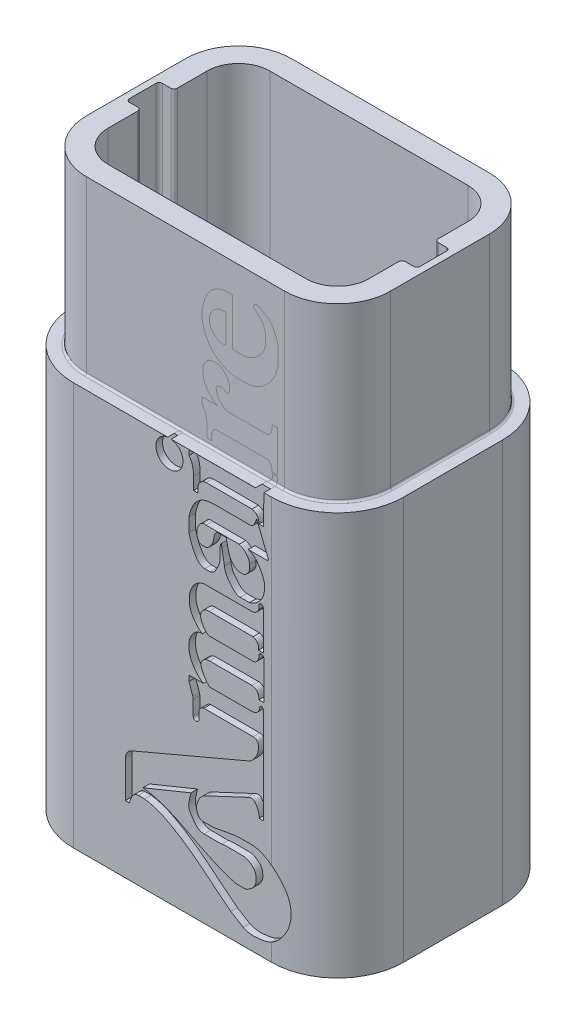
from build123d import *

# Parameters (mm, degrees)
SALIENTE_EXTRUIR1_DEPTH = 61
SALIENTE_EXTRUIR2_DEPTH = 26
VACIADO2_T              = -5.25
REDONDEO1_R             = 0.3
CORTAR_EXTRUIR1_REACH   = 89.26
CROQUIS3_R              = 7.5
CORTAR_EXTRUIR3_DEPTH   = 31.25
CROQUIS7_W              = 3
CROQUIS7_H              = 5
CORTAR_EXTRUIR4_DEPTH   = 81.75
REDONDEO7_R             = 0.5
CORTAR_EXTRUIR5_REACH   = 89.26
CORTAR_EXTRUIR6_DEPTH   = 1
CORTAR_EXTRUIR7_DEPTH   = 2


with BuildPart() as part:
    # Croquis1 → Saliente-Extruir1 (new body)
    with BuildSketch(Plane(origin=(0, 0, 0), x_dir=(1, 0, 0), z_dir=(0, 1, 0))):
        with BuildLine():
            Line((-15, 17.5), (15, 17.5))
            ThreePointArc((15, 17.5), (22.071067812, 14.571067812), (25, 7.5))
            Line((25, 7.5), (25, -7.5))
            ThreePointArc((25, -7.5), (22.071067812, -14.571067812), (15, -17.5))
            Line((15, -17.5), (-15, -17.5))
            ThreePointArc((-15, -17.5), (-22.071067812, -14.571067812), (-25, -7.5))
            Line((-25, -7.5), (-25, 7.5))
            ThreePointArc((-25, 7.5), (-22.071067812, 14.571067812), (-15, 17.5))
        make_face()
    extrude(amount=SALIENTE_EXTRUIR1_DEPTH)

    # Croquis2 → Saliente-Extruir2 (add)
    with BuildSketch(Plane(origin=(0, 61, 0), x_dir=(1, 0, 0), z_dir=(0, 1, 0))):
        with BuildLine():
            Line((15, 15.5), (-15, 15.5))
            ThreePointArc((-15, 15.5), (-20.656854249, 13.156854249), (-23, 7.5))
            Line((-23, 7.5), (-23, -7.5))
            ThreePointArc((-23, -7.5), (-20.656854249, -13.156854249), (-15, -15.5))
            Line((-15, -15.5), (15, -15.5))
            ThreePointArc((15, -15.5), (20.656854249, -13.156854249), (23, -7.5))
            Line((23, -7.5), (23, 7.5))
            ThreePointArc((23, 7.5), (20.656854249, 13.156854249), (15, 15.5))
        make_face()
    extrude(amount=SALIENTE_EXTRUIR2_DEPTH)

    # Vaciado2
    vaciado2_openings = [part.faces().sort_by_distance(p)[0] for p in [
        (0, 87, 0),
    ]]
    offset(amount=VACIADO2_T, openings=vaciado2_openings, kind=Kind.INTERSECTION)

    # Redondeo1
    redondeo1_edges = [part.edges().sort_by_distance(p)[0] for p in [
        (20.656854249, 61, -13.156854249),
        (0, 61, -15.5),
        (-20.656854249, 61, -13.156854249),
        (-23, 61, 0),
        (-20.656854249, 61, 13.156854249),
        (0, 61, 15.5),
        (20.656854249, 61, 13.156854249),
        (23, 61, 0),
    ]]
    fillet(redondeo1_edges, radius=REDONDEO1_R)

    # Croquis3 → Cortar-Extruir1 (cut, up to next)
    with BuildSketch(Plane(origin=(0, 5.25, 0), x_dir=(1, 0, 0), z_dir=(0, 1, 0)), mode=Mode.PRIVATE) as cortar_extruir1_sk1:
        with Locations(Location((0, 0, 0), (0, 0, 270))):
            Circle(CROQUIS3_R)
    cortar_extruir1_tool1 = extrude(cortar_extruir1_sk1.sketch, amount=-CORTAR_EXTRUIR1_REACH, mode=Mode.PRIVATE) & part.part
    add(cortar_extruir1_tool1.solids().sort_by_distance((0, 5.25, 0))[0], mode=Mode.SUBTRACT)

    # Croquis6 → Cortar-Extruir3 (cut)
    with BuildSketch(Plane.XZ.offset(-55.75)):
        with BuildLine():
            Line((19.75, -7.5), (19.75, 7.5))
            ThreePointArc((19.75, 7.5), (18.358757211, 10.858757211), (15, 12.25))
            Line((15, 12.25), (-15, 12.25))
            ThreePointArc((-15, 12.25), (-18.358757211, 10.858757211), (-19.75, 7.5))
            Line((-19.75, 7.5), (-19.75, -7.5))
            ThreePointArc((-19.75, -7.5), (-18.358757211, -10.858757211), (-15, -12.25))
            Line((-15, -12.25), (15, -12.25))
            ThreePointArc((15, -12.25), (18.358757211, -10.858757211), (19.75, -7.5))
        make_face()
        with BuildLine():
            Line((15, 10.25), (-15, 10.25))
            ThreePointArc((-15, 10.25), (-16.944543648, 9.444543648), (-17.75, 7.5))
            Line((-17.75, 7.5), (-17.75, -7.5))
            ThreePointArc((-17.75, -7.5), (-16.944543648, -9.444543648), (-15, -10.25))
            Line((-15, -10.25), (15, -10.25))
            ThreePointArc((15, -10.25), (16.944543648, -9.444543648), (17.75, -7.5))
            Line((17.75, -7.5), (17.75, 7.5))
            ThreePointArc((17.75, 7.5), (16.944543648, 9.444543648), (15, 10.25))
        make_face(mode=Mode.SUBTRACT)
    extrude(amount=-CORTAR_EXTRUIR3_DEPTH, mode=Mode.SUBTRACT)

    # Croquis7 → Cortar-Extruir4 (cut)
    with BuildSketch(Plane(origin=(0, 5.25, 0), x_dir=(1, 0, 0), z_dir=(0, 1, 0))):
        with Locations((-20.5, 0)):
            Rectangle(CROQUIS7_W, CROQUIS7_H)
        with Locations((20.5, 0)):
            Rectangle(CROQUIS7_W, CROQUIS7_H)
    extrude(amount=CORTAR_EXTRUIR4_DEPTH, mode=Mode.SUBTRACT)

    # Redondeo7
    redondeo7_edges = [part.edges().sort_by_distance(p)[0] for p in [
        (-22, 46.125, -2.5),
        (-19.75, 46.125, 2.5),
        (-22, 46.125, 2.5),
        (-19.75, 46.125, -2.5),
        (22, 46.125, 2.5),
        (19.75, 46.125, -2.5),
        (22, 46.125, -2.5),
        (19.75, 46.125, 2.5),
    ]]
    fillet(redondeo7_edges, radius=REDONDEO7_R)

    # Croquis8 → Cortar-Extruir5 (cut, up to next)
    with BuildSketch(Plane(origin=(0, 5.25, 0), x_dir=(1, 0, 0), z_dir=(0, 1, 0)), mode=Mode.PRIVATE) as cortar_extruir5_sk1:
        with BuildLine():
            Line((-1.5, 10.071067812), (1.5, 10.071067812))
            ThreePointArc((1.5, 10.071067812), (2.207106781, 9.778174593), (2.5, 9.071067812))
            Line((2.5, 9.071067812), (2.5, 7.071067812))
            Line((2.5, 7.071067812), (-2.5, 7.071067812))
            Line((-2.5, 7.071067812), (-2.5, 9.071067812))
            ThreePointArc((-2.5, 9.071067812), (-2.207106781, 9.778174593), (-1.5, 10.071067812))
        make_face()
    cortar_extruir5_tool1 = extrude(cortar_extruir5_sk1.sketch, amount=-CORTAR_EXTRUIR5_REACH, mode=Mode.PRIVATE) & part.part
    # Croquis8 → Cortar-Extruir5 (cut, up to next)
    with BuildSketch(Plane(origin=(0, 5.25, 0), x_dir=(1, 0, 0), z_dir=(0, 1, 0)), mode=Mode.PRIVATE) as cortar_extruir5_sk2:
        with BuildLine():
            Line((9.071067812, 2.5), (7.071067812, 2.5))
            Line((7.071067812, 2.5), (7.071067812, -2.5))
            Line((7.071067812, -2.5), (9.071067812, -2.5))
            ThreePointArc((9.071067812, -2.5), (9.778174593, -2.207106781), (10.071067812, -1.5))
            Line((10.071067812, -1.5), (10.071067812, 1.5))
            ThreePointArc((10.071067812, 1.5), (9.778174593, 2.207106781), (9.071067812, 2.5))
        make_face()
    cortar_extruir5_tool2 = extrude(cortar_extruir5_sk2.sketch, amount=-CORTAR_EXTRUIR5_REACH, mode=Mode.PRIVATE) & part.part
    # Croquis8 → Cortar-Extruir5 (cut, up to next)
    with BuildSketch(Plane(origin=(0, 5.25, 0), x_dir=(1, 0, 0), z_dir=(0, 1, 0)), mode=Mode.PRIVATE) as cortar_extruir5_sk3:
        with BuildLine():
            Line((2.5, -9.071067812), (2.5, -7.071067812))
            Line((2.5, -7.071067812), (-2.5, -7.071067812))
            Line((-2.5, -7.071067812), (-2.5, -9.071067812))
            ThreePointArc((-2.5, -9.071067812), (-2.207106781, -9.778174593), (-1.5, -10.071067812))
            Line((-1.5, -10.071067812), (1.5, -10.071067812))
            ThreePointArc((1.5, -10.071067812), (2.207106781, -9.778174593), (2.5, -9.071067812))
        make_face()
    cortar_extruir5_tool3 = extrude(cortar_extruir5_sk3.sketch, amount=-CORTAR_EXTRUIR5_REACH, mode=Mode.PRIVATE) & part.part
    # Croquis8 → Cortar-Extruir5 (cut, up to next)
    with BuildSketch(Plane(origin=(0, 5.25, 0), x_dir=(1, 0, 0), z_dir=(0, 1, 0)), mode=Mode.PRIVATE) as cortar_extruir5_sk4:
        with BuildLine():
            Line((-9.071067812, -2.5), (-7.071067812, -2.5))
            Line((-7.071067812, -2.5), (-7.071067812, 2.5))
            Line((-7.071067812, 2.5), (-9.071067812, 2.5))
            ThreePointArc((-9.071067812, 2.5), (-9.778174593, 2.207106781), (-10.071067812, 1.5))
            Line((-10.071067812, 1.5), (-10.071067812, -1.5))
            ThreePointArc((-10.071067812, -1.5), (-9.778174593, -2.207106781), (-9.071067812, -2.5))
        make_face()
    cortar_extruir5_tool4 = extrude(cortar_extruir5_sk4.sketch, amount=-CORTAR_EXTRUIR5_REACH, mode=Mode.PRIVATE) & part.part
    add(cortar_extruir5_tool1.solids().sort_by_distance((0, 5.25, -8.533463))[0], mode=Mode.SUBTRACT)
    add(cortar_extruir5_tool2.solids().sort_by_distance((8.533463, 5.25, 0))[0], mode=Mode.SUBTRACT)
    add(cortar_extruir5_tool3.solids().sort_by_distance((0, 5.25, 8.533463))[0], mode=Mode.SUBTRACT)
    add(cortar_extruir5_tool4.solids().sort_by_distance((-8.533463, 5.25, 0))[0], mode=Mode.SUBTRACT)

    # Croquis12 → Cortar-Extruir6 (cut)
    # profile 1 of 4: a face of its own
    with BuildSketch(Plane.XY.offset(17.5)):
        with BuildLine():
            Line((8.839211837, 3.583016121), (10.717378559, 2.448750729))
            add(Edge.make_bspline(
                [(10.717378559, 2.448750729), (11.57151276, 1.992908575), (12.833194057, 2.068391278), (14.284742415, 2.323841876), (14.785601891, 2.538291683), (15, 2.654255198)],
                knots=[0, 0, 0, 0, 0.110699318, 0.146587548, 0.175473468, 0.175473468, 0.175473468, 0.175473468], degree=3))
            add(Edge.make_bspline(
                [(15, 2.654255198), (15.439441542, 2.891940063), (15.821183504, 3.199624631), (16.32789766, 3.742235966), (16.483231519, 3.935082502), (16.763900815, 4.337452763), (16.889919542, 4.54799845), (17.113674208, 4.987937813), (17.210809933, 5.216508236), (17.373276031, 5.679853562), (17.439364062, 5.916052732), (17.542494062, 6.397257135), (17.579619908, 6.643904279), (17.623710647, 7.136476573), (17.638158034, 7.628226678), (17.595541347, 8.118391174), (17.5236616, 8.607746805), (17.472782707, 8.851451729), (17.280521565, 9.563069163), (17.099711225, 10.018169016), (16.639584889, 10.893600197), (16.366888971, 11.301223226), (15.743538376, 12.058376014), (15.389473625, 12.410261964), (15, 12.719037435)],
                knots=[0, 0, 0, 0, 0.125, 0.125, 0.1875, 0.1875, 0.25, 0.25, 0.3125, 0.3125, 0.375, 0.375, 0.4375, 0.4375, 0.5, 0.5625, 0.5625, 0.625, 0.625, 0.75, 0.75, 0.875, 0.875, 1, 1, 1, 1], degree=3))
            add(Edge.make_bspline(
                [(15, 12.719037435), (14.836502756, 12.848658379), (14.156768101, 13.33788541), (12.86992764, 13.933832597), (10.93208066, 13.947892843), (8.728536164, 13.855241706), (7.114546126, 13.41627319), (6.210708059, 13.288192066)],
                knots=[0.637512638, 0.637512638, 0.637512638, 0.637512638, 0.66233274, 0.736891382, 0.801940894, 0.890990195, 1, 1, 1, 1], degree=3))
            Line((6.210708059, 13.288192066), (4.469200106, 13.288192066))
            add(Edge.make_bspline(
                [(4.469200106, 13.288192066), (3.627161847, 13.632506122), (3.457839165, 15.425230162), (4.488611443, 16.650693169), (5.225852576, 16.936315268)],
                knots=[0, 0, 0, 0, 0.504715202, 1, 1, 1, 1], degree=3))
            Line((5.225852576, 16.936315268), (11.341427702, 19.803222446))
            add(Edge.make_bspline(
                [(11.341427702, 19.803222446), (12.054473478, 20.172278232), (12.637173074, 19.779522002), (13.201444155, 18.547801031), (13.144488155, 17.954358588)],
                knots=[0, 0, 0, 0, 0.367215736, 1, 1, 1, 1], degree=3))
            Line((13.144488155, 17.954358588), (13.753717827, 17.954358588))
            Line((13.753717827, 17.954358588), (13.753717827, 32.534911479))
            ThreePointArc((13.753717827, 32.534911479), (13.488425616, 32.791359046), (13.223133405, 32.534911479))
            add(Edge.make_bspline(
                [(13.223133405, 32.534911479), (13.215001476, 32.295131831), (13.054278265, 31.711951829), (12.474315741, 31.495679929), (12.203438302, 31.410580989)],
                knots=[0, 0, 0, 0, 0.450574226, 1, 1, 1, 1], degree=3))
            Line((12.203438302, 31.410580989), (5.606071271, 31.410580989))
            add(Edge.make_bspline(
                [(5.606071271, 31.410580989), (5.146499522, 31.872242801), (4.61752502, 32.611723133), (4.287669726, 33.60736524), (4.361329758, 34.113086922), (4.736192448, 34.60744645), (5.215658678, 34.831363959), (5.606071271, 34.824708089)],
                knots=[0, 0, 0, 0, 0.423126115, 0.602373381, 0.670712459, 0.750833857, 1, 1, 1, 1], degree=3))
            Line((5.606071271, 34.824708089), (12.033103981, 34.824708089))
            add(Edge.make_bspline(
                [(12.033103981, 34.824708089), (12.724694773, 34.834167703), (13.182039204, 34.097752865), (13.097016367, 33.471702843)],
                knots=[0, 0, 0, 0, 1, 1, 1, 1], degree=3))
            Line((13.097016367, 33.471702843), (13.837263132, 33.471702843))
            Line((13.837263132, 33.471702843), (13.837263132, 39.253100651))
            ThreePointArc((13.837263132, 39.253100651), (13.467139749, 39.651933844), (13.097016367, 39.253100651))
            add(Edge.make_bspline(
                [(13.097016367, 39.253100651), (13.136464163, 38.725556963), (12.782038468, 38.111566482), (12.203438302, 38.075965764)],
                knots=[0, 0, 0, 0, 1, 1, 1, 1], degree=3))
            Line((12.203438302, 38.075965764), (5.547357888, 38.075965764))
            add(Edge.make_bspline(
                [(5.547357888, 38.075965764), (5.144189999, 38.189826714), (4.633272205, 38.90097659), (4.162459873, 39.904636812), (4.446579724, 41.018611774), (5.135275013, 41.334215678), (5.547357888, 41.296087898)],
                knots=[0, 0, 0, 0, 0.274690439, 0.562076696, 0.721942945, 1, 1, 1, 1], degree=3))
            Line((5.547357888, 41.296087898), (12.203438302, 41.296087898))
            add(Edge.make_bspline(
                [(12.203438302, 41.296087898), (12.771063201, 41.156708415), (13.202012477, 40.523510491), (13.032571939, 39.942966797)],
                knots=[0, 0, 0, 0, 1, 1, 1, 1], degree=3))
            Line((13.032571939, 39.942966797), (13.753717827, 39.942966797))
            Line((13.753717827, 39.942966797), (13.753717827, 45.891922131))
            ThreePointArc((13.753717827, 45.891922131), (13.433316373, 46.203340455), (13.11291492, 45.891922131))
            Line((13.11291492, 45.891922131), (13.097016367, 45.332930437))
            add(Edge.make_bspline(
                [(13.097016367, 45.332930437), (12.833869284, 44.618628689), (12.089132907, 44.522899109)],
                knots=[0, 0, 0, 1, 1, 1], degree=2))
            Line((12.089132907, 44.522899109), (4.878009071, 44.522899109))
            add(Edge.make_bspline(
                [(4.878009071, 44.522899109), (2.977027214, 44.264896519), (1.809187864, 40.771717503), (3.596770436, 38.473383224), (4.518193173, 37.828668084)],
                knots=[0, 0, 0, 0, 0.604964868, 1, 1, 1, 1], degree=3))
            add(Edge.make_bspline(
                [(4.518193173, 37.828668084), (3.732085133, 37.893846761), (2.622380687, 36.822945378), (2.247877206, 34.006879288), (3.540265622, 32.164048112), (4.679290925, 31.410580989)],
                knots=[0, 0, 0, 0, 0.268806293, 0.492798793, 1, 1, 1, 1], degree=3))
            Line((4.679290925, 31.410580989), (2.500918979, 31.410580989))
            Line((2.500918979, 31.410580989), (2.500918979, 30.567340236))
            Line((2.500918979, 30.567340236), (3.092546042, 28.905085597))
            ThreePointArc((3.092546042, 28.905085597), (3.135859711, 28.739909553), (3.150439311, 28.569772448))
            Line((3.150439311, 28.569772448), (3.150439311, 26.348861371))
            ThreePointArc((3.150439311, 26.348861371), (3.578274675, 25.921026008), (4.006110038, 26.348861371))
            Line((4.006110038, 26.348861371), (4.006110038, 27.493610047))
            add(Edge.make_bspline(
                [(4.006110038, 27.493610047), (4.178165485, 28.062386245), (4.761458333, 28.193395808)],
                knots=[0, 0, 0, 1, 1, 1], degree=2))
            Line((4.761458333, 28.193395808), (12.203438302, 28.193395808))
            add(Edge.make_bspline(
                [(12.203438302, 28.193395808), (12.876284158, 28.187443245), (13.323257717, 26.673308023), (12.491951558, 25.388573232), (11.815008673, 24.790967296)],
                knots=[0, 0, 0, 0, 0.347774106, 1, 1, 1, 1], degree=3))
            Line((11.815008673, 24.790967296), (-6.140696224, 17.152184365))
            add(Edge.make_bspline(
                [(-6.140696224, 17.152184365), (-7.06275562, 16.735030098), (-7.120593366, 15.721338435)],
                knots=[0, 0, 0, 1, 1, 1], degree=2))
            Line((-7.120593366, 15.721338435), (-7.120593366, 10.1336631))
            Line((-7.120593366, 10.1336631), (-6.54072951, 10.1336631))
            add(Edge.make_bspline(
                [(-6.54072951, 10.1336631), (-6.302525785, 10.770955801), (-6.067313414, 11.822632186), (-5.15727482, 11.811981922)],
                knots=[0, 0, 0, 0, 1, 1, 1, 1], degree=3))
            Line((-5.15727482, 11.811981922), (-4.208794013, 11.811981922))
            add(Edge.make_bspline(
                [(-4.208794013, 11.811981922), (-2.764436782, 11.633273815), (2.05605331, 9.51758502), (5.883582234, 5.856502973), (8.839211837, 3.583016121)],
                knots=[0, 0, 0, 0, 0.276950224, 1, 1, 1, 1], degree=3))
        make_face()
        with BuildLine():
            Line((9.52240161, 7.634356159), (11.065169804, 7.634356159))
            add(Edge.make_bspline(
                [(11.065169804, 7.634356159), (11.78995243, 7.867040882), (12.742944997, 8.756419367), (12.689327825, 10.003253389), (12.523332553, 10.78586972), (11.934738414, 11.348219099), (11.240384605, 11.751715912), (10.561697801, 11.830618826), (9.825488984, 11.805360715), (8.75774332, 11.813153641), (7.931487036, 11.822106284), (7.415172777, 11.723658503)],
                knots=[0, 0, 0, 0, 0.258068931, 0.344056016, 0.395908481, 0.514195451, 0.591542714, 0.6539393, 0.731991711, 0.831118274, 1, 1, 1, 1], degree=3))
            Line((7.415172777, 11.723658503), (4.797081459, 11.723658503))
            add(Edge.make_bspline(
                [(4.797081459, 11.723658503), (3.930766451, 11.711394291), (3.140212556, 12.70791639), (2.198786219, 14.330803789), (2.714890092, 15.496848038), (2.796732511, 16.118255614)],
                knots=[0, 0, 0, 0, 0.442283824, 0.611703227, 1, 1, 1, 1], degree=3))
            Line((2.796732511, 16.118255614), (-4.480049519, 13.150453386))
            add(Edge.make_bspline(
                [(-4.480049519, 13.150453386), (-2.655693689, 12.976130266), (1.393579189, 11.472757348), (5.733952227, 8.84403454), (8.818966871, 7.870468), (9.52240161, 7.634356159)],
                knots=[0, 0, 0, 0, 0.359356466, 0.85256814, 1, 1, 1, 1], degree=3))
        make_face(mode=Mode.SUBTRACT)
    # profile 2 of 4: a face of its own
    with BuildSketch(Plane.XY.offset(17.5)):
        with BuildLine():
            Line((11.492004893, 52.375748015), (14.331933762, 52.375748015))
            ThreePointArc((14.331933762, 52.375748015), (14.492691159, 52.461082808), (14.512088153, 52.642048895))
            Line((14.512088153, 52.642048895), (13.279747614, 55.716464977))
            Line((13.279747614, 55.716464977), (12.769675908, 56.987837595))
            add(Edge.make_bspline(
                [(12.769675908, 56.987837595), (12.648557654, 56.786183877), (12.486237294, 56.400747267), (12.265670553, 55.735908684), (11.815008673, 55.716464977)],
                knots=[0, 0, 0, 0, 0.319064042, 1, 1, 1, 1], degree=3))
            Line((11.815008673, 55.716464977), (6.210708059, 55.716464977))
            add(Edge.make_bspline(
                [(6.210708059, 55.716464977), (5.555162796, 55.693827315), (4.524691356, 55.52871533), (3.078761845, 54.25092926), (2.676682829, 53.016399971), (2.500918979, 52.138550548)],
                knots=[0, 0, 0, 0, 0.355063263, 0.516259989, 1, 1, 1, 1], degree=3))
            Line((2.500918979, 52.138550548), (2.500918979, 50.078886466))
            add(Edge.make_bspline(
                [(2.500918979, 50.078886466), (2.67318588, 49.313349475), (3.155493412, 47.99812536), (4.115182609, 46.606423341), (4.878009071, 46.563592823)],
                knots=[0, 0, 0, 0, 0.51301477, 1, 1, 1, 1], degree=3))
            Line((4.878009071, 46.563592823), (5.714767431, 46.563592823))
            add(Edge.make_bspline(
                [(5.714767431, 46.563592823), (6.243276049, 46.630762079), (6.633362058, 47.291522475), (7.142454693, 48.287502539), (7.233389841, 48.925627303), (7.233389841, 49.307196041)],
                knots=[0, 0, 0, 0, 0.405494088, 0.676354081, 1, 1, 1, 1], degree=3))
            Line((7.233389841, 49.307196041), (7.233389841, 50.615830926))
            add(Edge.make_bspline(
                [(7.233389841, 50.615830926), (7.233389841, 50.685510677), (7.258717074, 50.858797403), (7.299184894, 51.038897718), (7.414788877, 51.073138121), (7.450668403, 51.006236209), (7.44509675, 50.841668495), (7.440902814, 50.821484908), (7.478073382, 50.615830926)],
                knots=[0, 0, 0, 0, 0.283846614, 0.469195573, 0.535338885, 0.577900949, 0.677403481, 1, 1, 1, 1], degree=3))
            Line((7.478073382, 50.615830926), (7.872015, 48.43626608))
            add(Edge.make_bspline(
                [(7.872015, 48.43626608), (7.948469403, 47.5675699), (8.634057943, 46.574275946), (9.718190618, 45.490747845), (10.259634817, 45.490747845)],
                knots=[0, 0, 0, 0, 0.59464257, 1, 1, 1, 1], degree=3))
            Line((10.259634817, 45.490747845), (11.662725988, 45.490747845))
            add(Edge.make_bspline(
                [(11.662725988, 45.490747845), (13.217323905, 45.949543618), (13.753717827, 47.427680167)],
                knots=[0, 0, 0, 1, 1, 1], degree=2))
            add(Edge.make_bspline(
                [(13.753717827, 47.427680167), (13.990018632, 48.078852452), (14.063434627, 49.330081298), (13.126658702, 51.153349746), (12.239698815, 52.167753465), (11.492004893, 52.375748015)],
                knots=[0, 0, 0, 0, 0.318596554, 0.637556037, 1, 1, 1, 1], degree=3))
        make_face()
        with BuildLine():
            Line((11.662725988, 49.814567272), (11.662725988, 50.53823427))
            add(Edge.make_bspline(
                [(11.662725988, 50.53823427), (11.585936845, 51.403868377), (10.902405792, 52.105651691), (10.112619778, 52.375748015)],
                knots=[0, 0, 0, 0, 1, 1, 1, 1], degree=3))
            Line((10.112619778, 52.375748015), (5.119689652, 52.375748015))
            add(Edge.make_bspline(
                [(5.119689652, 52.375748015), (4.330613038, 52.56893691), (3.890848717, 51.754441334), (3.720694472, 51.150779685)],
                knots=[0, 0, 0, 0, 1, 1, 1, 1], degree=3))
            Line((3.720694472, 51.150779685), (3.720694472, 50.363845424))
            add(Edge.make_bspline(
                [(3.720694472, 50.363845424), (3.820842612, 50.000805081), (3.935884254, 49.479264501), (4.427943083, 49.441529193)],
                knots=[0, 0, 0, 0, 1, 1, 1, 1], degree=3))
            Line((4.427943083, 49.441529193), (5.119689652, 49.441529193))
            add(Edge.make_bspline(
                [(5.119689652, 49.441529193), (5.482819524, 49.590461247), (5.914679144, 50.095849146), (6.361085441, 51.136278747), (6.319111238, 52.197221742), (6.927864154, 52.281452691)],
                knots=[0, 0, 0, 0, 0.331250303, 0.531334128, 1, 1, 1, 1], degree=3))
            Line((6.927864154, 52.281452691), (8.143954627, 52.281452691))
            add(Edge.make_bspline(
                [(8.143954627, 52.281452691), (8.366910211, 51.381857376), (8.454675875, 49.731284444), (9.698436086, 48.84649654), (10.112619778, 48.747907325)],
                knots=[0, 0, 0, 0, 0.702137344, 1, 1, 1, 1], degree=3))
            Line((10.112619778, 48.747907325), (10.794486994, 48.747907325))
            add(Edge.make_bspline(
                [(10.794486994, 48.747907325), (11.504829949, 49.049421937), (11.662725988, 49.814567272)],
                knots=[0, 0, 0, 1, 1, 1], degree=2))
        make_face(mode=Mode.SUBTRACT)
    # profile 3 of 4: a face of its own
    with BuildSketch(Plane.XY.offset(17.5)):
        with BuildLine():
            Line((-0.193142673, 61), (-0.711646695, 61))
            ThreePointArc((-0.711646695, 61), (-0.452394684, 56.908388908), (-0.193142673, 61))
        make_face()
    # profile 4 of 4: a face of its own
    with BuildSketch(Plane.XY.offset(17.5)):
        with BuildLine():
            Line((13.862447588, 61), (12.572893394, 61))
            ThreePointArc((12.572893394, 61), (12.556005346, 60.994346074), (12.539046884, 60.988906994))
            Line((12.539046884, 60.988906994), (2.500918979, 60.988906994))
            Line((2.500918979, 60.988906994), (2.500918979, 60.187054794))
            add(Edge.make_bspline(
                [(2.500918979, 60.187054794), (3.085064389, 59.581123101), (3.166586955, 58.688636749), (3.212183195, 57.899939832)],
                knots=[0, 0, 0, 0, 1, 1, 1, 1], degree=3))
            Line((3.212183195, 57.899939832), (3.212183195, 55.972655268))
            Line((3.212183195, 55.972655268), (3.888292768, 55.972655268))
            Line((3.888292768, 55.972655268), (3.888292768, 56.782449957))
            add(Edge.make_bspline(
                [(3.888292768, 56.782449957), (3.887736783, 57.437729798), (4.511693612, 57.919977126), (5.119689652, 57.955952707)],
                knots=[0, 0, 0, 0, 1, 1, 1, 1], degree=3))
            Line((5.119689652, 57.955952707), (12.033103981, 57.955952707))
            add(Edge.make_bspline(
                [(12.033103981, 57.955952707), (13.095110797, 57.70792487), (13.11291492, 56.51178231)],
                knots=[0, 0, 0, 1, 1, 1], degree=2))
            Line((13.11291492, 56.51178231), (13.753717827, 56.51178231))
            Line((13.753717827, 56.51178231), (13.862447588, 61))
        make_face()
    extrude(amount=-CORTAR_EXTRUIR6_DEPTH, mode=Mode.SUBTRACT)

    # Croquis13 → Cortar-Extruir7 (cut)
    with BuildSketch(Plane(origin=(0, 5.25, 0), x_dir=(1, 0, 0), z_dir=(0, 1, 0))):
        with BuildLine():
            Line((-22, 2), (-22, -2))
            ThreePointArc((-22, -2), (-21.853553391, -2.353553391), (-21.5, -2.5))
            Line((-21.5, -2.5), (-20.25, -2.5))
            ThreePointArc((-20.25, -2.5), (-19.896446609, -2.646446609), (-19.75, -3))
            Line((-19.75, -3), (-19.75, -7.5))
            ThreePointArc((-19.75, -7.5), (-18.358757211, -10.858757211), (-15, -12.25))
            Line((-15, -12.25), (15, -12.25))
            ThreePointArc((15, -12.25), (18.358757211, -10.858757211), (19.75, -7.5))
            Line((19.75, -7.5), (19.75, -3))
            ThreePointArc((19.75, -3), (19.896446609, -2.646446609), (20.25, -2.5))
            Line((20.25, -2.5), (21.5, -2.5))
            ThreePointArc((21.5, -2.5), (21.853553391, -2.353553391), (22, -2))
            Line((22, -2), (22, 2))
            ThreePointArc((22, 2), (21.853553391, 2.353553391), (21.5, 2.5))
            Line((21.5, 2.5), (20.25, 2.5))
            ThreePointArc((20.25, 2.5), (19.896446609, 2.646446609), (19.75, 3))
            Line((19.75, 3), (19.75, 7.5))
            ThreePointArc((19.75, 7.5), (18.358757211, 10.858757211), (15, 12.25))
            Line((15, 12.25), (-15, 12.25))
            ThreePointArc((-15, 12.25), (-18.358757211, 10.858757211), (-19.75, 7.5))
            Line((-19.75, 7.5), (-19.75, 3))
            ThreePointArc((-19.75, 3), (-19.896446609, 2.646446609), (-20.25, 2.5))
            Line((-20.25, 2.5), (-21.5, 2.5))
            ThreePointArc((-21.5, 2.5), (-21.853553391, 2.353553391), (-22, 2))
        make_face()
    extrude(amount=-CORTAR_EXTRUIR7_DEPTH, mode=Mode.SUBTRACT)


solid = part.part
